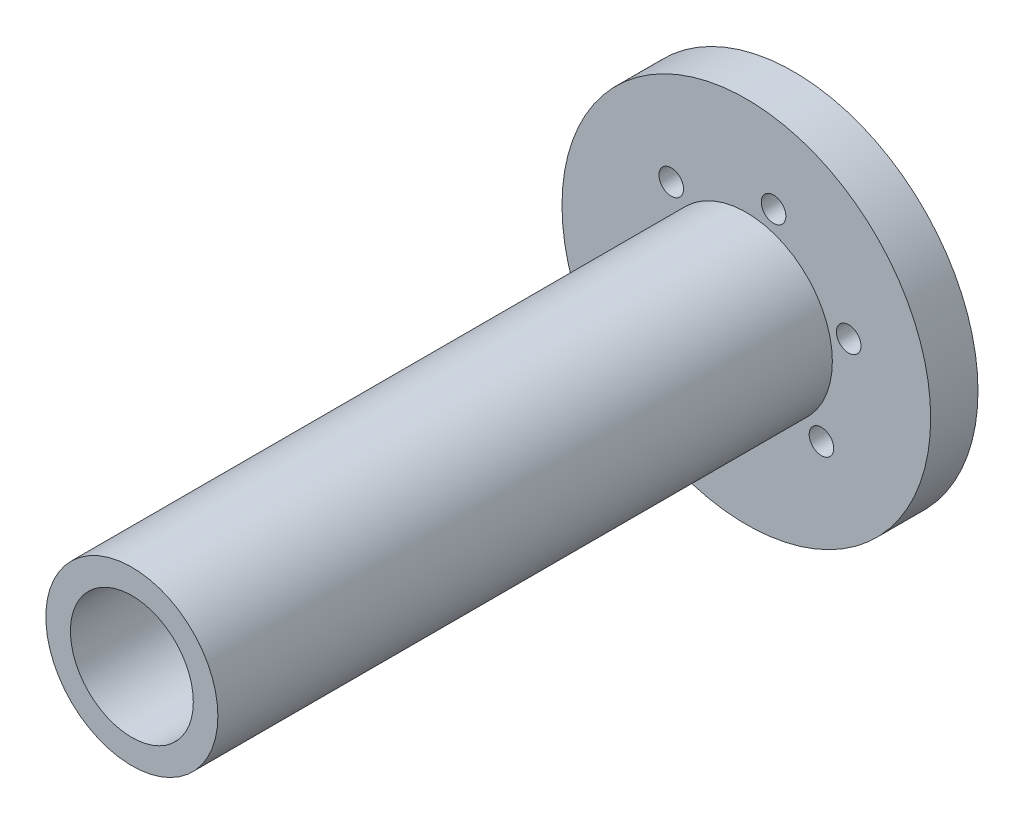
from build123d import *

# Parameters (mm, degrees)
SKETCH_1_R            = 50
EXTRUDE_1_DEPTH       = 7.7
SKETCH_2_R            = 2
CUT_EXTRUDE_1_DEPTH   = 7.7
SKETCH_3_R            = 14
SKETCH_3_R_2          = 10
EXTRUDE_1_2_DEPTH     = 100
SKETCH_4_R            = 74
SKETCH_4_R_2          = 30
CUT_EXTRUDE_1_2_DEPTH = 10


with BuildPart() as part:
    # 草图1 → Extrude 1 (new body)
    with BuildSketch(Plane.XY):
        with Locations(Location((0, 0, 0), (0, 0, 180))):
            Circle(SKETCH_1_R)
    extrude(amount=EXTRUDE_1_DEPTH)

    # 草图2 → Cut-Extrude 1 (cut)
    with BuildSketch(Plane.XY.offset(7.7)):
        with Locations((4.428990597, 16.671728833)):
            Circle(SKETCH_2_R)
        with Locations((16.652635993, 4.500246046)):
            Circle(SKETCH_2_R)
        with Locations((12.223645396, -12.171482787)):
            Circle(SKETCH_2_R)
        with Locations((-4.428990597, -16.671728833)):
            Circle(SKETCH_2_R)
        with Locations((-16.652635993, -4.500246046)):
            Circle(SKETCH_2_R)
        with Locations((-12.223645396, 12.171482787)):
            Circle(SKETCH_2_R)
    extrude(amount=-CUT_EXTRUDE_1_DEPTH, mode=Mode.SUBTRACT)

    # 草图3 → Extrude 1 2 (add)
    with BuildSketch(Plane.XY.offset(7.7)):
        Circle(SKETCH_3_R)
        Circle(SKETCH_3_R_2, mode=Mode.SUBTRACT)
    extrude(amount=EXTRUDE_1_2_DEPTH)

    # 草图4 → Cut-Extrude 1 2 (cut)
    with BuildSketch(Plane.XY.offset(7.7)):
        Circle(SKETCH_4_R)
        Circle(SKETCH_4_R_2, mode=Mode.SUBTRACT)
    extrude(amount=-CUT_EXTRUDE_1_2_DEPTH, mode=Mode.SUBTRACT)


solid = part.part
